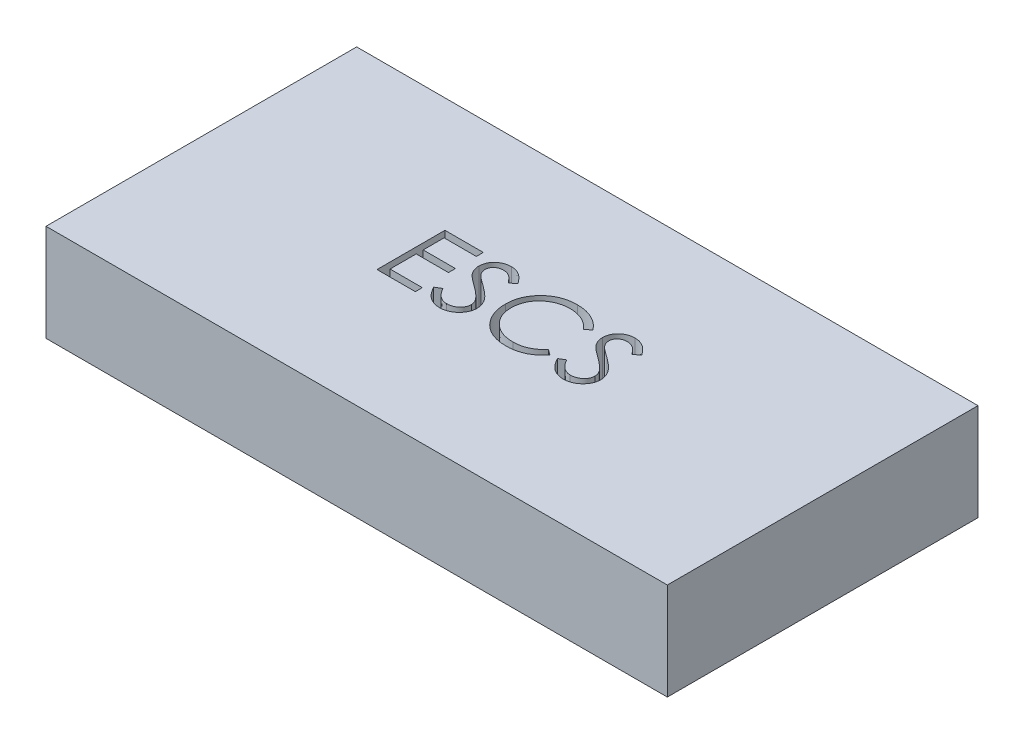
from build123d import *

# Parameters (mm, degrees)
SKETCH1_W           = 32
SKETCH1_H           = 16
BOSS_EXTRUDE1_DEPTH = 5
CUT_EXTRUDE3_DEPTH  = 2


with BuildPart() as part:
    # Sketch1 → Boss-Extrude1 (new body)
    with BuildSketch(Plane(origin=(0, 0, 0), x_dir=(1, 0, 0), z_dir=(0, 1, 0))):
        with Locations((-1.41697417, 5.431734317)):
            Rectangle(SKETCH1_W, SKETCH1_H)
    extrude(amount=BOSS_EXTRUDE1_DEPTH)

    # Sketch3 → Cut-Extrude3 (cut)
    with BuildSketch(Plane(origin=(0, 5, 0), x_dir=(1, 0, 0), z_dir=(0, 1, 0))):
        Polygon((-6.963735289, 7.525897846), (-4.989376315, 7.525897846), (-4.989376315, 7.166923487), (-6.649632725, 7.166923487), (-6.649632725, 6.09000041), (-4.989376315, 6.09000041), (-4.989376315, 5.731026051), (-6.649632725, 5.731026051), (-6.649632725, 4.384872205), (-4.989376315, 4.384872205), (-4.989376315, 4.025897846), (-6.963735289, 4.025897846), align=None)
        with BuildLine():
            Line((-4.720145546, 4.701078135), (-4.424272148, 4.878461949))
            add(Edge.make_bspline(
                [(-4.424272148, 4.878461949), (-4.396753911, 4.832397564), (-4.34403003, 4.74413998), (-4.256078671, 4.624881939), (-4.16494576, 4.523519783), (-4.069956427, 4.440643175), (-3.971690478, 4.375394288), (-3.869506425, 4.329192057), (-3.763748614, 4.300376081), (-3.691774792, 4.296875995), (-3.655842661, 4.295128615)],
                knots=[0, 0, 0, 0, 1.272034388, 2.437168799, 3.508375237, 4.49857839, 5.41946034, 6.295179144, 7.148887113, 8, 8, 8, 8], degree=3))
            add(Edge.make_bspline(
                [(-3.655842661, 4.295128615), (-3.625155801, 4.295983288), (-3.564319028, 4.297677678), (-3.474756785, 4.31395848), (-3.387774982, 4.338970609), (-3.305166345, 4.374791541), (-3.22807073, 4.418130026), (-3.160464035, 4.470476204), (-3.102017922, 4.52908241), (-3.054208807, 4.594465064), (-3.017528772, 4.664782213), (-2.989336703, 4.736958164), (-2.97369163, 4.812126732), (-2.971334876, 4.862737195), (-2.970145546, 4.888277654)],
                knots=[0, 0, 0, 0, 1.095163259, 2.171163733, 3.241058638, 4.321873601, 5.38011039, 6.391990106, 7.366004449, 8.327778327, 9.272591725, 10.192022065, 11.087607919, 12, 12, 12, 12], degree=3))
            add(Edge.make_bspline(
                [(-2.970145546, 4.888277654), (-2.971619856, 4.917418504), (-2.974616915, 4.976657593), (-2.999948395, 5.064057246), (-3.039797642, 5.150549816), (-3.076560285, 5.204051081), (-3.095646347, 5.231827333)],
                knots=[0, 0, 0, 0, 0.938893495, 1.908633276, 2.914225137, 4, 4, 4, 4], degree=3))
            add(Edge.make_bspline(
                [(-3.095646347, 5.231827333), (-3.111316961, 5.251874157), (-3.144215455, 5.293959956), (-3.200772968, 5.356605191), (-3.267139082, 5.42122361), (-3.341042637, 5.490282667), (-3.425175726, 5.560570464), (-3.516903241, 5.635438742), (-3.618567099, 5.712040319), (-3.689866596, 5.763412884), (-3.726655962, 5.789920282)],
                knots=[0, 0, 0, 0, 0.722233717, 1.516239348, 2.393582979, 3.351407094, 4.387010283, 5.505090956, 6.712668013, 8, 8, 8, 8], degree=3))
            add(Edge.make_bspline(
                [(-3.726655962, 5.789920282), (-3.763479959, 5.81614887), (-3.833884635, 5.866295932), (-3.932343217, 5.940720216), (-4.02038768, 6.008764085), (-4.097626697, 6.071068098), (-4.164026294, 6.127640702), (-4.220109705, 6.177938641), (-4.264448262, 6.223322202), (-4.289103843, 6.252763544), (-4.300173591, 6.265981981)],
                knots=[0, 0, 0, 0, 1.452282411, 2.77665338, 3.964542531, 5.026858415, 5.96415736, 6.766646006, 7.446254459, 8, 8, 8, 8], degree=3))
            add(Edge.make_bspline(
                [(-4.300173591, 6.265981981), (-4.315646136, 6.286583018), (-4.346074973, 6.327097721), (-4.386240978, 6.390422579), (-4.420380141, 6.455245845), (-4.447142473, 6.521741709), (-4.469678692, 6.588976638), (-4.484836622, 6.657827884), (-4.494328019, 6.727986502), (-4.495300006, 6.775200003), (-4.495786571, 6.798834545)],
                knots=[0, 0, 0, 0, 1.068054152, 2.10047183, 3.106115577, 4.101338837, 5.06977816, 6.043150881, 7.020423561, 8, 8, 8, 8], degree=3))
            add(Edge.make_bspline(
                [(-4.495786571, 6.798834545), (-4.494481362, 6.835864319), (-4.491898842, 6.909132383), (-4.470058325, 7.016163214), (-4.435585431, 7.118349631), (-4.387290544, 7.214679965), (-4.325033191, 7.302645945), (-4.252987216, 7.383259432), (-4.16717573, 7.451028015), (-4.073023107, 7.510240073), (-3.969966735, 7.556585998), (-3.861975831, 7.591546978), (-3.748878759, 7.611356236), (-3.672275625, 7.614199001), (-3.633406764, 7.615641436)],
                knots=[0, 0, 0, 0, 1.005424448, 1.989358655, 2.955360095, 3.929531133, 4.905563448, 5.876582895, 6.856512386, 7.866279853, 8.892233794, 9.918561126, 10.94386622, 12, 12, 12, 12], degree=3))
            add(Edge.make_bspline(
                [(-3.633406764, 7.615641436), (-3.592162663, 7.614218884), (-3.510141312, 7.611389883), (-3.389492096, 7.586792352), (-3.27333138, 7.54609168), (-3.179888115, 7.499903022), (-3.106755353, 7.453771606), (-3.050982621, 7.411751782), (-2.99446517, 7.363376674), (-2.936747115, 7.308517427), (-2.878806456, 7.246670676), (-2.819783003, 7.178259987), (-2.759538735, 7.103703432), (-2.720782874, 7.050478931), (-2.700914776, 7.023193519)],
                knots=[0, 0, 0, 0, 1.286793592, 2.559021753, 3.825965368, 5.121522368, 5.803751409, 6.523245864, 7.299691795, 8.125521123, 9.008227632, 9.944561021, 10.946284179, 12, 12, 12, 12], degree=3))
            Line((-2.700914776, 7.023193519), (-2.984869103, 6.807949128))
            add(Edge.make_bspline(
                [(-2.984869103, 6.807949128), (-3.002015036, 6.830037819), (-3.035034093, 6.872575472), (-3.08516358, 6.932146787), (-3.132412228, 6.986563267), (-3.178962628, 7.033828395), (-3.222356259, 7.076530528), (-3.264473301, 7.113090285), (-3.304707652, 7.143865881), (-3.355424563, 7.176709441), (-3.419142281, 7.209265944), (-3.499126818, 7.236815022), (-3.582713093, 7.253370084), (-3.639642724, 7.255558972), (-3.668462853, 7.256667077)],
                knots=[0, 0, 0, 0, 1.181633172, 2.275549214, 3.290209073, 4.226197932, 5.078386478, 5.862611352, 6.581680152, 7.217281963, 8.414376989, 9.595101626, 10.782541182, 12, 12, 12, 12], degree=3))
            add(Edge.make_bspline(
                [(-3.668462853, 7.256667077), (-3.704619376, 7.255455377), (-3.774343823, 7.253118728), (-3.873334059, 7.227598742), (-3.962427984, 7.187416882), (-4.038980549, 7.131101904), (-4.102717526, 7.064380911), (-4.148822985, 6.987602056), (-4.17657315, 6.902819654), (-4.179959429, 6.843677997), (-4.181684007, 6.813558103)],
                knots=[0, 0, 0, 0, 1.14458467, 2.207223713, 3.21896685, 4.227309161, 5.202851033, 6.127160689, 7.046193047, 8, 8, 8, 8], degree=3))
            add(Edge.make_bspline(
                [(-4.181684007, 6.813558103), (-4.181290881, 6.794806624), (-4.180503984, 6.757273005), (-4.169529187, 6.701821583), (-4.155429858, 6.646510243), (-4.133087226, 6.59158766), (-4.102241922, 6.536093301), (-4.061736747, 6.479071564), (-4.010723435, 6.420019855), (-3.971646422, 6.381612481), (-3.951014937, 6.361334545)],
                knots=[0, 0, 0, 0, 0.858281714, 1.717966888, 2.583508476, 3.4729293, 4.427298488, 5.488583878, 6.674047936, 8, 8, 8, 8], degree=3))
            add(Edge.make_bspline(
                [(-3.951014937, 6.361334545), (-3.943353564, 6.354497519), (-3.925151897, 6.338254311), (-3.891875971, 6.31166203), (-3.847933173, 6.278859258), (-3.794470972, 6.238271941), (-3.73050361, 6.191190479), (-3.656024054, 6.138216867), (-3.571862521, 6.077631408), (-3.512140605, 6.035273867), (-3.480562212, 6.012877013)],
                knots=[0, 0, 0, 0, 0.420754252, 0.999615792, 1.744751191, 2.668019286, 3.750313428, 4.999500688, 6.413464383, 8, 8, 8, 8], degree=3))
            add(Edge.make_bspline(
                [(-3.480562212, 6.012877013), (-3.442576299, 5.985235653), (-3.369021843, 5.931711992), (-3.264364263, 5.851296311), (-3.169470455, 5.772648543), (-3.084007251, 5.696270936), (-3.007130343, 5.622742843), (-2.939692622, 5.551179662), (-2.881006942, 5.48209409), (-2.817827723, 5.393521514), (-2.753269904, 5.28474043), (-2.697828396, 5.151462191), (-2.662870049, 5.017665871), (-2.658298533, 4.927739034), (-2.656042982, 4.883369801)],
                knots=[0, 0, 0, 0, 1.163667725, 2.253281268, 3.268753668, 4.215851969, 5.092017293, 5.902905408, 6.650798638, 7.335211899, 8.59617414, 9.77448103, 10.901945474, 12, 12, 12, 12], degree=3))
            add(Edge.make_bspline(
                [(-2.656042982, 4.883369801), (-2.65670012, 4.851991436), (-2.658001635, 4.789844053), (-2.672962549, 4.698588976), (-2.694882214, 4.609958106), (-2.727919448, 4.525046994), (-2.768242606, 4.442302231), (-2.819408854, 4.363894331), (-2.878716539, 4.288087932), (-2.946750303, 4.216904441), (-3.021196206, 4.151558245), (-3.0998799, 4.093429183), (-3.182930173, 4.04496086), (-3.26989649, 4.005410018), (-3.360798827, 3.9744765), (-3.455606611, 3.952063631), (-3.554476122, 3.93830792), (-3.621676603, 3.936880159), (-3.655842661, 3.936154256)],
                knots=[0, 0, 0, 0, 0.983748083, 1.948392443, 2.894712957, 3.844097841, 4.80183111, 5.778335162, 6.776009319, 7.81870978, 8.863265674, 9.881300176, 10.883814829, 11.87499822, 12.874611388, 13.892143829, 14.928324115, 16, 16, 16, 16], degree=3))
            add(Edge.make_bspline(
                [(-3.655842661, 3.936154256), (-3.682278004, 3.936665438), (-3.734815764, 3.937681363), (-3.812525246, 3.946662644), (-3.888664835, 3.959369747), (-3.962279117, 3.979543817), (-4.034316529, 4.004020794), (-4.104463763, 4.034159127), (-4.172754817, 4.070276328), (-4.2395724, 4.111571353), (-4.304746575, 4.159629098), (-4.367666043, 4.215602594), (-4.430395228, 4.277948099), (-4.491082624, 4.348358662), (-4.550955769, 4.425696745), (-4.608834178, 4.510685929), (-4.665915896, 4.602863282), (-4.701731364, 4.667728368), (-4.720145546, 4.701078135)],
                knots=[0, 0, 0, 0, 0.915332311, 1.819136955, 2.706846663, 3.586547465, 4.459518054, 5.340707479, 6.227863349, 7.133153174, 8.059268498, 9.028702269, 10.047606654, 11.120612155, 12.245963614, 13.433783089, 14.680604001, 16, 16, 16, 16], degree=3))
        make_face()
        with BuildLine():
            Line((1.292674967, 6.883670282), (1.017835224, 6.673333744))
            add(Edge.make_bspline(
                [(1.017835224, 6.673333744), (0.998229335, 6.696699713), (0.959281888, 6.743116629), (0.896622686, 6.808296174), (0.831321043, 6.869361435), (0.763401922, 6.926603315), (0.691642802, 6.97802008), (0.617782004, 7.026291183), (0.540583958, 7.069558921), (0.433832224, 7.122021907), (0.294184375, 7.176768062), (0.118389536, 7.222671294), (-0.065121562, 7.251892469), (-0.190319162, 7.255057311), (-0.253999712, 7.256667077)],
                knots=[0, 0, 0, 0, 0.757959112, 1.505699292, 2.245454638, 2.979532153, 3.711538275, 4.438200793, 5.171680507, 5.909471876, 7.393775596, 8.890124382, 10.418191784, 12, 12, 12, 12], degree=3))
            add(Edge.make_bspline(
                [(-0.253999712, 7.256667077), (-0.289083012, 7.256263114), (-0.358924004, 7.255458939), (-0.462572478, 7.244849813), (-0.564285529, 7.229938603), (-0.663996995, 7.20781328), (-0.761579954, 7.179840661), (-0.857672356, 7.146415247), (-0.950882956, 7.105060407), (-1.042501194, 7.059352147), (-1.130280405, 7.007724703), (-1.213335453, 6.951411351), (-1.29136342, 6.891042254), (-1.364426033, 6.826391148), (-1.432597981, 6.757749187), (-1.495385292, 6.684384846), (-1.552570702, 6.606532672), (-1.605287727, 6.525219265), (-1.65250046, 6.440681473), (-1.69203034, 6.352606403), (-1.727035462, 6.2625023), (-1.754734705, 6.169351139), (-1.776659221, 6.073808373), (-1.791786885, 5.975617585), (-1.802275356, 5.874983905), (-1.803075533, 5.806774593), (-1.803478879, 5.772392237)],
                knots=[0, 0, 0, 0, 1.054917814, 2.100044995, 3.131103042, 4.146048494, 5.169673617, 6.183595914, 7.203665975, 8.234915748, 9.262203917, 10.264457458, 11.251630812, 12.227803204, 13.197192746, 14.159520551, 15.12972552, 16.100847026, 17.073214652, 18.039054194, 19.002613845, 19.979014051, 20.95965708, 21.949030935, 22.966165397, 24, 24, 24, 24], degree=3))
            add(Edge.make_bspline(
                [(-1.803478879, 5.772392237), (-1.80221706, 5.720660917), (-1.799739646, 5.619093332), (-1.777691312, 5.470322722), (-1.74418622, 5.327802048), (-1.693970643, 5.192422206), (-1.632051593, 5.062513848), (-1.553810981, 4.940274994), (-1.463194444, 4.82385843), (-1.358920025, 4.716015482), (-1.244514209, 4.617501757), (-1.121766297, 4.530751175), (-0.990982009, 4.458436293), (-0.853605379, 4.398260346), (-0.708579265, 4.352003619), (-0.556164463, 4.319439495), (-0.396692467, 4.298197315), (-0.287723068, 4.296163626), (-0.232264937, 4.295128615)],
                knots=[0, 0, 0, 0, 1.029171465, 2.020641659, 2.987623507, 3.938342917, 4.889210282, 5.84687017, 6.821220943, 7.821438502, 8.827599549, 9.822697543, 10.807740252, 11.797342354, 12.80366471, 13.83203677, 14.896651826, 16, 16, 16, 16], degree=3))
            add(Edge.make_bspline(
                [(-0.232264937, 4.295128615), (-0.171162248, 4.296817395), (-0.050897539, 4.300141318), (0.125470488, 4.328300567), (0.294306253, 4.373958485), (0.45561884, 4.437856407), (0.608953486, 4.520921695), (0.754550146, 4.621619572), (0.892531717, 4.740907905), (0.975502999, 4.831991033), (1.017835224, 4.878461949)],
                knots=[0, 0, 0, 0, 1.028121516, 2.023589091, 2.998037872, 3.967518031, 4.937445131, 5.927275754, 6.942489185, 8, 8, 8, 8], degree=3))
            Line((1.017835224, 4.878461949), (1.292674967, 4.670228776))
            add(Edge.make_bspline(
                [(1.292674967, 4.670228776), (1.270556857, 4.641690324), (1.226426582, 4.584750117), (1.154968565, 4.504478408), (1.079691268, 4.428974372), (1.000035558, 4.358846751), (0.916917766, 4.292692285), (0.828845454, 4.232390454), (0.736976421, 4.17709957), (0.641621942, 4.126472645), (0.542883329, 4.081555398), (0.440878894, 4.043101631), (0.336048319, 4.009976741), (0.228386811, 3.982724804), (0.117671054, 3.96145372), (0.00430058, 3.947234046), (-0.111969296, 3.937492131), (-0.190410717, 3.936604215), (-0.230161571, 3.936154256)],
                knots=[0, 0, 0, 0, 0.986787822, 1.968848986, 2.935600012, 3.899624008, 4.868462664, 5.837806735, 6.815139263, 7.798259679, 8.787526145, 9.778297419, 10.776456485, 11.791383307, 12.812564526, 13.85620153, 14.913611965, 16, 16, 16, 16], degree=3))
            add(Edge.make_bspline(
                [(-0.230161571, 3.936154256), (-0.267805238, 3.936416249), (-0.342240928, 3.936934307), (-0.45213968, 3.945326474), (-0.559129261, 3.956776211), (-0.662903887, 3.974016342), (-0.764029862, 3.994360682), (-0.861590446, 4.021631939), (-0.956545657, 4.052181105), (-1.048513997, 4.088086092), (-1.137573697, 4.128602275), (-1.223437509, 4.174393834), (-1.306065941, 4.225075698), (-1.386271362, 4.279530709), (-1.462868945, 4.339508011), (-1.536522471, 4.404174645), (-1.607644947, 4.473312656), (-1.651647632, 4.523167509), (-1.673771347, 4.548233583)],
                knots=[0, 0, 0, 0, 1.114604814, 2.203992996, 3.262667896, 4.300477797, 5.318619304, 6.316056647, 7.298880507, 8.271930387, 9.238335007, 10.195173496, 11.151986948, 12.108099108, 13.064862484, 14.031167946, 15.010108607, 16, 16, 16, 16], degree=3))
            add(Edge.make_bspline(
                [(-1.673771347, 4.548233583), (-1.70920699, 4.591774772), (-1.779650467, 4.678331483), (-1.869776151, 4.818617464), (-1.946923706, 4.965085673), (-2.009299627, 5.118505602), (-2.05806236, 5.278532989), (-2.091843555, 5.445248503), (-2.11379516, 5.618496445), (-2.116305448, 5.736333234), (-2.117581443, 5.796230378)],
                knots=[0, 0, 0, 0, 0.994628077, 1.977248131, 2.950237994, 3.925870899, 4.908910175, 5.911660606, 6.938484602, 8, 8, 8, 8], degree=3))
            add(Edge.make_bspline(
                [(-2.117581443, 5.796230378), (-2.11602625, 5.859185832), (-2.112966503, 5.983046756), (-2.086970708, 6.16482071), (-2.045151912, 6.338972108), (-1.985755023, 6.505175853), (-1.910449672, 6.664306133), (-1.817423058, 6.815147338), (-1.707755916, 6.958664138), (-1.582308348, 7.092678889), (-1.444741013, 7.215218242), (-1.297422199, 7.323024445), (-1.140640252, 7.412741961), (-0.9761224, 7.487738124), (-0.802636719, 7.545382587), (-0.62055335, 7.585735774), (-0.430214435, 7.61085289), (-0.300352009, 7.614028098), (-0.234368302, 7.615641436)],
                knots=[0, 0, 0, 0, 1.032925535, 2.032216505, 3.007276963, 3.968222605, 4.92396291, 5.891752235, 6.871517503, 7.883894988, 8.900124299, 9.891468569, 10.874487609, 11.85992873, 12.854644235, 13.869047385, 14.917252991, 16, 16, 16, 16], degree=3))
            add(Edge.make_bspline(
                [(-0.234368302, 7.615641436), (-0.19415383, 7.615159298), (-0.114553333, 7.614204954), (0.00319932, 7.604898812), (0.117841646, 7.589385205), (0.229452629, 7.568269136), (0.338575245, 7.542061814), (0.444375486, 7.507921516), (0.547474172, 7.468884984), (0.647221081, 7.423926519), (0.743137631, 7.373459777), (0.835193949, 7.318044154), (0.922658808, 7.257748348), (1.006147656, 7.193085173), (1.084263868, 7.122686613), (1.159225346, 7.048489017), (1.228486424, 6.968355193), (1.271239619, 6.911950259), (1.292674967, 6.883670282)],
                knots=[0, 0, 0, 0, 1.096760587, 2.17092713, 3.219439832, 4.250915756, 5.268269357, 6.278326846, 7.281116186, 8.274029601, 9.260640565, 10.235837813, 11.203064059, 12.156899882, 13.114053108, 14.069676657, 15.032185724, 16, 16, 16, 16], degree=3))
        make_face()
        with BuildLine():
            Line((1.651649326, 4.701078135), (1.947522724, 4.878461949))
            add(Edge.make_bspline(
                [(1.947522724, 4.878461949), (1.975040961, 4.832397564), (2.027764841, 4.74413998), (2.115716201, 4.624881939), (2.206849112, 4.523519783), (2.301838445, 4.440643175), (2.400104393, 4.375394288), (2.502288447, 4.329192057), (2.608046258, 4.300376081), (2.680020079, 4.296875995), (2.715952211, 4.295128615)],
                knots=[0, 0, 0, 0, 1.272034388, 2.437168799, 3.508375237, 4.49857839, 5.41946034, 6.295179144, 7.148887113, 8, 8, 8, 8], degree=3))
            add(Edge.make_bspline(
                [(2.715952211, 4.295128615), (2.746639071, 4.295983288), (2.807475844, 4.297677678), (2.897038087, 4.31395848), (2.984019889, 4.338970609), (3.066628527, 4.374791541), (3.143724142, 4.418130026), (3.211330837, 4.470476204), (3.26977695, 4.52908241), (3.317586065, 4.594465064), (3.3542661, 4.664782213), (3.382458169, 4.736958164), (3.398103242, 4.812126732), (3.400459996, 4.862737195), (3.401649326, 4.888277654)],
                knots=[0, 0, 0, 0, 1.095163259, 2.171163733, 3.241058638, 4.321873601, 5.38011039, 6.391990106, 7.366004449, 8.327778327, 9.272591725, 10.192022065, 11.087607919, 12, 12, 12, 12], degree=3))
            add(Edge.make_bspline(
                [(3.401649326, 4.888277654), (3.400175015, 4.917418504), (3.397177957, 4.976657593), (3.371846477, 5.064057246), (3.33199723, 5.150549816), (3.295234587, 5.204051081), (3.276148525, 5.231827333)],
                knots=[0, 0, 0, 0, 0.938893495, 1.908633276, 2.914225137, 4, 4, 4, 4], degree=3))
            add(Edge.make_bspline(
                [(3.276148525, 5.231827333), (3.260477911, 5.251874157), (3.227579416, 5.293959956), (3.171021904, 5.356605191), (3.104655789, 5.42122361), (3.030752235, 5.490282667), (2.946619146, 5.560570464), (2.854891631, 5.635438742), (2.753227772, 5.712040319), (2.681928276, 5.763412884), (2.645138909, 5.789920282)],
                knots=[0, 0, 0, 0, 0.722233717, 1.516239348, 2.393582979, 3.351407094, 4.387010283, 5.505090956, 6.712668013, 8, 8, 8, 8], degree=3))
            add(Edge.make_bspline(
                [(2.645138909, 5.789920282), (2.608314913, 5.81614887), (2.537910237, 5.866295932), (2.439451654, 5.940720216), (2.351407191, 6.008764085), (2.274168175, 6.071068098), (2.207768578, 6.127640702), (2.151685167, 6.177938641), (2.10734661, 6.223322202), (2.082691029, 6.252763544), (2.071621281, 6.265981981)],
                knots=[0, 0, 0, 0, 1.452282411, 2.77665338, 3.964542531, 5.026858415, 5.96415736, 6.766646006, 7.446254459, 8, 8, 8, 8], degree=3))
            add(Edge.make_bspline(
                [(2.071621281, 6.265981981), (2.056148736, 6.286583018), (2.025719899, 6.327097721), (1.985553894, 6.390422579), (1.951414731, 6.455245845), (1.924652399, 6.521741709), (1.90211618, 6.588976638), (1.886958249, 6.657827884), (1.877466852, 6.727986502), (1.876494866, 6.775200003), (1.8760083, 6.798834545)],
                knots=[0, 0, 0, 0, 1.068054152, 2.10047183, 3.106115577, 4.101338837, 5.06977816, 6.043150881, 7.020423561, 8, 8, 8, 8], degree=3))
            add(Edge.make_bspline(
                [(1.8760083, 6.798834545), (1.877313509, 6.835864319), (1.87989603, 6.909132383), (1.901736547, 7.016163214), (1.93620944, 7.118349631), (1.984504328, 7.214679965), (2.046761681, 7.302645945), (2.118807656, 7.383259432), (2.204619142, 7.451028015), (2.298771765, 7.510240073), (2.401828137, 7.556585998), (2.509819041, 7.591546978), (2.622916113, 7.611356236), (2.699519247, 7.614199001), (2.738388108, 7.615641436)],
                knots=[0, 0, 0, 0, 1.005424448, 1.989358655, 2.955360095, 3.929531133, 4.905563448, 5.876582895, 6.856512386, 7.866279853, 8.892233794, 9.918561126, 10.94386622, 12, 12, 12, 12], degree=3))
            add(Edge.make_bspline(
                [(2.738388108, 7.615641436), (2.779632208, 7.614218884), (2.86165356, 7.611389883), (2.982302776, 7.586792352), (3.098463492, 7.54609168), (3.191906757, 7.499903022), (3.265039518, 7.453771606), (3.320812251, 7.411751782), (3.377329702, 7.363376674), (3.435047757, 7.308517427), (3.492988416, 7.246670676), (3.552011868, 7.178259987), (3.612256137, 7.103703432), (3.651011997, 7.050478931), (3.670880095, 7.023193519)],
                knots=[0, 0, 0, 0, 1.286793592, 2.559021753, 3.825965368, 5.121522368, 5.803751409, 6.523245864, 7.299691795, 8.125521123, 9.008227632, 9.944561021, 10.946284179, 12, 12, 12, 12], degree=3))
            Line((3.670880095, 7.023193519), (3.386925768, 6.807949128))
            add(Edge.make_bspline(
                [(3.386925768, 6.807949128), (3.369779836, 6.830037819), (3.336760779, 6.872575472), (3.286631292, 6.932146787), (3.239382644, 6.986563267), (3.192832244, 7.033828395), (3.149438613, 7.076530528), (3.107321571, 7.113090285), (3.067087219, 7.143865881), (3.016370309, 7.176709441), (2.95265259, 7.209265944), (2.872668054, 7.236815022), (2.789081779, 7.253370084), (2.732152148, 7.255558972), (2.703332018, 7.256667077)],
                knots=[0, 0, 0, 0, 1.181633172, 2.275549214, 3.290209073, 4.226197932, 5.078386478, 5.862611352, 6.581680152, 7.217281963, 8.414376989, 9.595101626, 10.782541182, 12, 12, 12, 12], degree=3))
            add(Edge.make_bspline(
                [(2.703332018, 7.256667077), (2.667175496, 7.255455377), (2.597451049, 7.253118728), (2.498460812, 7.227598742), (2.409366887, 7.187416882), (2.332814322, 7.131101904), (2.269077345, 7.064380911), (2.222971887, 6.987602056), (2.195221722, 6.902819654), (2.191835442, 6.843677997), (2.190110865, 6.813558103)],
                knots=[0, 0, 0, 0, 1.14458467, 2.207223713, 3.21896685, 4.227309161, 5.202851033, 6.127160689, 7.046193047, 8, 8, 8, 8], degree=3))
            add(Edge.make_bspline(
                [(2.190110865, 6.813558103), (2.190503991, 6.794806624), (2.191290887, 6.757273005), (2.202265685, 6.701821583), (2.216365014, 6.646510243), (2.238707646, 6.59158766), (2.269552949, 6.536093301), (2.310058125, 6.479071564), (2.361071437, 6.420019855), (2.40014845, 6.381612481), (2.420779935, 6.361334545)],
                knots=[0, 0, 0, 0, 0.858281714, 1.717966888, 2.583508476, 3.4729293, 4.427298488, 5.488583878, 6.674047936, 8, 8, 8, 8], degree=3))
            add(Edge.make_bspline(
                [(2.420779935, 6.361334545), (2.428441307, 6.354497519), (2.446642975, 6.338254311), (2.4799189, 6.31166203), (2.523861699, 6.278859258), (2.5773239, 6.238271941), (2.641291261, 6.191190479), (2.715770818, 6.138216867), (2.79993235, 6.077631408), (2.859654266, 6.035273867), (2.891232659, 6.012877013)],
                knots=[0, 0, 0, 0, 0.420754252, 0.999615792, 1.744751191, 2.668019286, 3.750313428, 4.999500688, 6.413464383, 8, 8, 8, 8], degree=3))
            add(Edge.make_bspline(
                [(2.891232659, 6.012877013), (2.929218573, 5.985235653), (3.002773029, 5.931711992), (3.107430609, 5.851296311), (3.202324417, 5.772648543), (3.287787621, 5.696270936), (3.364664529, 5.622742843), (3.43210225, 5.551179662), (3.49078793, 5.48209409), (3.553967149, 5.393521514), (3.618524968, 5.28474043), (3.673966476, 5.151462191), (3.708924823, 5.017665871), (3.713496338, 4.927739034), (3.71575189, 4.883369801)],
                knots=[0, 0, 0, 0, 1.163667725, 2.253281268, 3.268753668, 4.215851969, 5.092017293, 5.902905408, 6.650798638, 7.335211899, 8.59617414, 9.77448103, 10.901945474, 12, 12, 12, 12], degree=3))
            add(Edge.make_bspline(
                [(3.71575189, 4.883369801), (3.715094752, 4.851991436), (3.713793237, 4.789844053), (3.698832323, 4.698588976), (3.676912658, 4.609958106), (3.643875424, 4.525046994), (3.603552266, 4.442302231), (3.552386018, 4.363894331), (3.493078333, 4.288087932), (3.425044568, 4.216904441), (3.350598666, 4.151558245), (3.271914971, 4.093429183), (3.188864698, 4.04496086), (3.101898382, 4.005410018), (3.010996045, 3.9744765), (2.916188261, 3.952063631), (2.81731875, 3.93830792), (2.750118268, 3.936880159), (2.715952211, 3.936154256)],
                knots=[0, 0, 0, 0, 0.983748083, 1.948392443, 2.894712957, 3.844097841, 4.80183111, 5.778335162, 6.776009319, 7.81870978, 8.863265674, 9.881300176, 10.883814829, 11.87499822, 12.874611388, 13.892143829, 14.928324115, 16, 16, 16, 16], degree=3))
            add(Edge.make_bspline(
                [(2.715952211, 3.936154256), (2.689516868, 3.936665438), (2.636979108, 3.937681363), (2.559269626, 3.946662644), (2.483130037, 3.959369747), (2.409515755, 3.979543817), (2.337478343, 4.004020794), (2.267331108, 4.034159127), (2.199040055, 4.070276328), (2.132222472, 4.111571353), (2.067048297, 4.159629098), (2.004128829, 4.215602594), (1.941399644, 4.277948099), (1.880712247, 4.348358662), (1.820839103, 4.425696745), (1.762960693, 4.510685929), (1.705878976, 4.602863282), (1.670063508, 4.667728368), (1.651649326, 4.701078135)],
                knots=[0, 0, 0, 0, 0.915332311, 1.819136955, 2.706846663, 3.586547465, 4.459518054, 5.340707479, 6.227863349, 7.133153174, 8.059268498, 9.028702269, 10.047606654, 11.120612155, 12.245963614, 13.433783089, 14.680604001, 16, 16, 16, 16], degree=3))
        make_face()
    extrude(amount=-CUT_EXTRUDE3_DEPTH, mode=Mode.SUBTRACT)


solid = part.part
